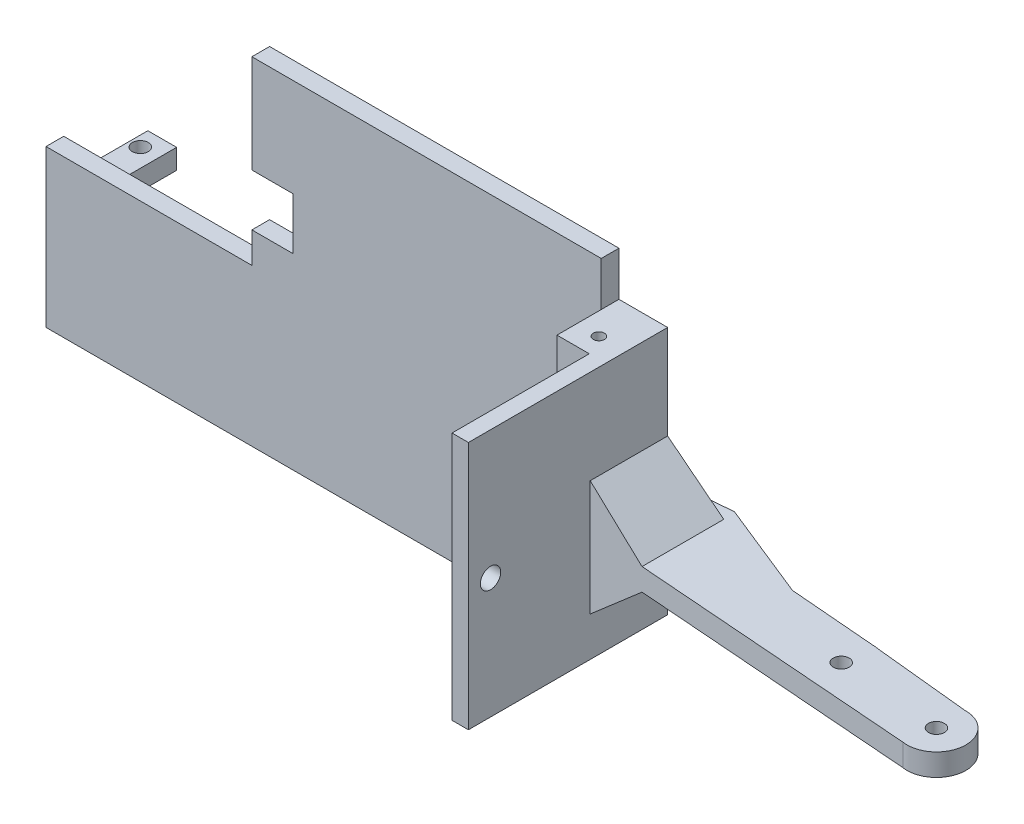
from build123d import *

# Parameters (mm, degrees)
SKETCH1_W                = 78.9
SKETCH1_H                = 4
BOSS_EXTRUDE1_DEPTH      = 76.2
SKETCH2_W                = 46.5
SKETCH2_H                = 26.89406393
BOSS_EXTRUDE2_DEPTH      = 4
SKETCH5_W                = 9.285994966
SKETCH5_H                = 11.707020407
CUT_EXTRUDE2_DEPTH       = 5
SKETCH6_R                = 1.25
CUT_EXTRUDE3_DEPTH       = 85
SKETCH7_W                = 10
SKETCH7_H                = 14
CUT_EXTRUDE4_DEPTH       = 10
SKETCH8_W                = 10
SKETCH8_H                = 14
CUT_EXTRUDE5_DEPTH       = 10
SKETCH9_W                = 3.7
SKETCH9_H                = 45
BOSS_EXTRUDE4_DEPTH      = 56.2
SKETCH10_W               = 46.5
SKETCH10_H               = 8.496116432
BOSS_EXTRUDE5_DEPTH      = 4
SKETCH11_W               = 6.644809846
SKETCH11_H               = 4.508222244
SKETCH11_W_2             = 6.5
BOSS_EXTRUDE6_DEPTH      = 19
SKETCH12_R               = 1.8
CUT_EXTRUDE6_DEPTH       = 19
SKETCH14_R               = 2.3
CUT_EXTRUDE7_DEPTH       = 10
BOSS_EXTRUDE7_DEPTH      = 5
SKETCH16_R               = 1.8
CUT_EXTRUDE8_DEPTH       = 10
BOSS_EXTRUDE8_DEPTH      = 21
BOSS_EXTRUDE9_DEPTH      = 5
CUT_EXTRUDE9_DEPTH       = 5
CUT_EXTRUDE10_DEPTH      = 25
CUT_EXTRUDE10_DEPTH_BACK = 25


with BuildPart() as part:
    # Sketch1 → Boss-Extrude1 (new body)
    with BuildSketch(Plane(origin=(0, 0, 0), x_dir=(1, 0, 0), z_dir=(0, 1, 0))):
        with Locations((39.45, 2)):
            Rectangle(SKETCH1_W, SKETCH1_H)
        Polygon((78.9, 4), (78.9, 0), (78.9, -10), (88.9, -10), (88.9, 4), align=None)
    extrude(amount=BOSS_EXTRUDE1_DEPTH)

    # Sketch2 → Boss-Extrude2 (add)
    with BuildSketch(Plane(origin=(0, 0, -4), x_dir=(-1, 0, 0), z_dir=(0, 0, -1))):
        with Locations((23.25, 13.447031965)):
            Rectangle(SKETCH2_W, SKETCH2_H)
    extrude(amount=-BOSS_EXTRUDE2_DEPTH)

    # Sketch5 → Cut-Extrude2 (cut)
    with BuildSketch(Plane(origin=(0, 0, -4), x_dir=(-1, 0, 0), z_dir=(0, 0, -1))):
        with Locations((-4.642997483, 48.187124879)):
            Rectangle(SKETCH5_W, SKETCH5_H)
    extrude(amount=-CUT_EXTRUDE2_DEPTH, mode=Mode.SUBTRACT)

    # Sketch6 → Cut-Extrude3 (cut)
    with BuildSketch(Plane(origin=(0, 0, 0), x_dir=(-1, 0, 0), z_dir=(0, -1, 0))):
        with Locations(Location((-83.868179675, -5.5, 0), (0, 0, 90))):
            Circle(SKETCH6_R)
    extrude(amount=-CUT_EXTRUDE3_DEPTH, mode=Mode.SUBTRACT)

    # Sketch7 → Cut-Extrude4 (cut)
    with BuildSketch(Plane.XZ):
        with Locations((83.9, 3)):
            Rectangle(SKETCH7_W, SKETCH7_H)
    extrude(amount=-CUT_EXTRUDE4_DEPTH, mode=Mode.SUBTRACT)

    # Sketch8 → Cut-Extrude5 (cut)
    with BuildSketch(Plane(origin=(0, 76.2, 0), x_dir=(1, 0, 0), z_dir=(0, 1, 0))):
        with Locations((83.9, -3)):
            Rectangle(SKETCH8_W, SKETCH8_H)
    extrude(amount=-CUT_EXTRUDE5_DEPTH, mode=Mode.SUBTRACT)

    # Sketch9 → Boss-Extrude4 (add)
    with BuildSketch(Plane(origin=(0, 66.2, 0), x_dir=(1, 0, 0), z_dir=(0, 1, 0))):
        with Locations((88.05, -18.5)):
            Rectangle(SKETCH9_W, SKETCH9_H)
    extrude(amount=-BOSS_EXTRUDE4_DEPTH)

    # Sketch10 → Boss-Extrude5 (add)
    with BuildSketch(Plane.XY):
        with Locations((-23.25, 31.142122146)):
            Rectangle(SKETCH10_W, SKETCH10_H)
    extrude(amount=-BOSS_EXTRUDE5_DEPTH)

    # Sketch11 → Boss-Extrude6 (add)
    with BuildSketch(Plane(origin=(0, 0, -4), x_dir=(-1, 0, 0), z_dir=(0, 0, -1))):
        with Locations((-3.622404923, 24.725888878)):
            Rectangle(SKETCH11_W, SKETCH11_H)
        with Locations((43.25, 24.725888878)):
            Rectangle(SKETCH11_W_2, SKETCH11_H)
    extrude(amount=BOSS_EXTRUDE6_DEPTH)

    # Sketch12 → Cut-Extrude6 (cut)
    with BuildSketch(Plane(origin=(0, 26.98, 0), x_dir=(1, 0, 0), z_dir=(0, 1, 0))):
        with Locations(Location((-44.15, 18.95, 0), (0, 0, 270))):
            Circle(SKETCH12_R)
        with Locations(Location((-44.15, 9.05, 0), (0, 0, 270))):
            Circle(SKETCH12_R)
        with Locations(Location((3.85, 18.95, 0), (0, 0, 270))):
            Circle(SKETCH12_R)
        with Locations(Location((3.85, 9.05, 0), (0, 0, 270))):
            Circle(SKETCH12_R)
    extrude(amount=-CUT_EXTRUDE6_DEPTH, mode=Mode.SUBTRACT)

    # Sketch14 → Cut-Extrude7 (cut)
    with BuildSketch(Plane(origin=(89.9, 0, 0), x_dir=(0, 0, -1), z_dir=(1, 0, 0))):
        with Locations((-36, 37.2)):
            Circle(SKETCH14_R)
    extrude(amount=-CUT_EXTRUDE7_DEPTH, mode=Mode.SUBTRACT)

    # Sketch15 → Boss-Extrude7 (add)
    with BuildSketch(Plane(origin=(0, 35, 0), x_dir=(-1, 0, 0), z_dir=(0, -1, 0))):
        with BuildLine():
            Line((-89.9, -16), (-89.9, 4))
            Line((-89.9, 4), (-167.391867849, -2.779659952))
            ThreePointArc((-167.391867849, -2.779659952), (-160.320800037, -5.70859214), (-157.391867849, -12.779659952))
            ThreePointArc((-157.391867849, -12.779659952), (-159.731423417, -19.207536049), (-165.655386072, -22.627737482))
            Line((-165.655386072, -22.627737482), (-89.9, -16))
        make_face()
        with BuildLine():
            ThreePointArc((-157.391867849, -12.779659952), (-160.320800037, -5.70859214), (-167.391867849, -2.779659952))
            Line((-167.391867849, -2.779659952), (-167.391867849, -22.779659952))
            Line((-167.391867849, -22.779659952), (-165.655386072, -22.627737482))
            ThreePointArc((-165.655386072, -22.627737482), (-159.731423417, -19.207536049), (-157.391867849, -12.779659952))
        make_face()
        with BuildLine():
            Line((-167.391867849, -22.779659952), (-167.391867849, -2.779659952))
            ThreePointArc((-167.391867849, -2.779659952), (-177.391867849, -12.779659952), (-167.391867849, -22.779659952))
        make_face()
    extrude(amount=BOSS_EXTRUDE7_DEPTH)

    # Sketch16 → Cut-Extrude8 (cut)
    with BuildSketch(Plane(origin=(0, 35, 0), x_dir=(1, 0, 0), z_dir=(0, 1, 0))):
        with Locations(Location((167.391867849, -12.779659952, 0), (0, 0, 270))):
            Circle(SKETCH16_R)
        with Locations(Location((143.856470685, -10.758777884, 0), (0, 0, 270))):
            Circle(SKETCH16_R)
    extrude(amount=-CUT_EXTRUDE8_DEPTH, mode=Mode.SUBTRACT)

    # Sketch17 → Boss-Extrude8 (add)
    with BuildSketch(Plane(origin=(0, 0, -4), x_dir=(-1, 0, 0), z_dir=(0, 0, -1))):
        Polygon((-89.9, 44.969099487), (-102.570211114, 35), (-102.570211114, 30), (-89.9, 18.896815366), align=None)
    extrude(amount=-BOSS_EXTRUDE8_DEPTH)

    # Sketch18 → Boss-Extrude9 (add)
    with BuildSketch(Plane(origin=(0, 35, 0), x_dir=(1, 0, 0), z_dir=(0, 1, 0))):
        Polygon((68.155607363, 4), (102.310564972, 6.689173102), (114.279885061, 1.867036439), align=None)
    extrude(amount=-BOSS_EXTRUDE9_DEPTH)

    # Sketch19 → Cut-Extrude9 (cut)
    with BuildSketch(Plane(origin=(0, 35, 0), x_dir=(1, 0, 0), z_dir=(0, 1, 0))):
        with BuildLine():
            Line((167.391867849, -2.779659952), (114.279885061, 1.867036439))
            Line((114.279885061, 1.867036439), (124.22443606, -2.139371913))
            Line((124.22443606, -2.139371913), (143.856470685, -3.758777884))
            ThreePointArc((143.856470685, -3.758777884), (144.565448389, -3.794773963), (145.267134545, -3.902391994))
            Line((145.267134545, -3.902391994), (167.251593152, -6.140542801))
            ThreePointArc((167.251593152, -6.140542801), (168.064444499, -6.173208999), (168.867202147, -6.305021565))
            ThreePointArc((168.867202147, -6.305021565), (172.582949472, -8.638376923), (174.032466733, -12.779659952))
            ThreePointArc((174.032466733, -12.779659952), (172.087480351, -17.475272454), (167.391867849, -19.420258836))
            ThreePointArc((167.391867849, -19.420258836), (166.885463525, -19.400921781), (166.382008444, -19.343023231))
            Line((166.382008444, -19.343023231), (144.811713642, -17.693293793))
            ThreePointArc((144.811713642, -17.693293793), (143.757690083, -17.758080878), (142.705914615, -17.66357482))
            Line((142.705914615, -17.66357482), (102.41543269, -17.09495848))
            Line((102.41543269, -17.09495848), (167.391867849, -22.779659952))
            ThreePointArc((167.391867849, -22.779659952), (177.391867849, -12.779659952), (167.391867849, -2.779659952))
        make_face()
    extrude(amount=-CUT_EXTRUDE9_DEPTH, mode=Mode.SUBTRACT)

    # Sketch21 → Cut-Extrude10 (cut, two sides: drawn at the far end of the back side and taken through both)
    with BuildSketch(Plane(origin=(0, 35, 0), x_dir=(1, 0, 0), z_dir=(0, 1, 0)).offset(-CUT_EXTRUDE10_DEPTH_BACK)):
        Polygon((148.965123629, -18.010952999), (89.9, -13.493561185), (89.9, -22.397972736), align=None)
    extrude(amount=CUT_EXTRUDE10_DEPTH + CUT_EXTRUDE10_DEPTH_BACK, mode=Mode.SUBTRACT)


solid = part.part
